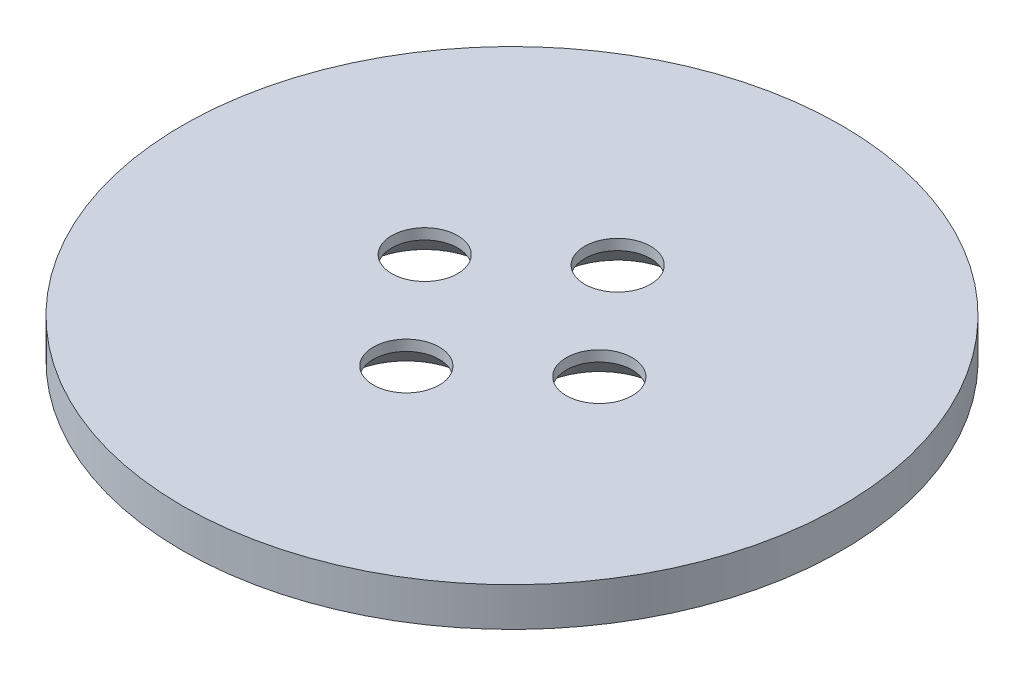
from build123d import *

# Parameters (mm, degrees)
SKETCH1_R                                    = 17
BOSS_EXTRUDE1_DEPTH                          = 2
CSK_FOR_M3_COUNTERSUNK_FLAT_HEAD_SCR_2_COUNT = 2
CSK_FOR_M3_COUNTERSUNK_FLAT_HEAD_SCR_2_PITCH = 7.071067812
CSK_FOR_M3_COUNTERSUNK_FLAT_HEAD_SCR_3_COUNT = 2
CSK_FOR_M3_COUNTERSUNK_FLAT_HEAD_SCR_3_PITCH = 10
CSK_FOR_M3_COUNTERSUNK_FLAT_HEAD_SCR_4_COUNT = 2
CSK_FOR_M3_COUNTERSUNK_FLAT_HEAD_SCR_4_PITCH = 7.071067812


with BuildPart() as part:
    # Sketch1 → Boss-Extrude1 (new body)
    with BuildSketch(Plane(origin=(0, 0, 0), x_dir=(1, 0, 0), z_dir=(0, 1, 0))):
        with Locations(Location((0, 0, 0), (0, 0, 270))):
            Circle(SKETCH1_R)
    extrude(amount=BOSS_EXTRUDE1_DEPTH)

    # Sketch3 → CSK for M3 Countersunk Flat Head Screw1 (revolve, cut)
    with BuildSketch(Plane(origin=(-4.977444323, 0, -0.474392252), x_dir=(0, 0, -1), z_dir=(1, 0, 0))):
        Polygon((0, 0), (0, 2), (1.7, 2), (1.7, 1.45), (3.15, 0), align=None)
    csk_for_m3_countersunk_flat_head_screw1 = revolve(axis=Axis((-4.977444323, -6.35, -0.474392252), (0, 1, 0)), mode=Mode.SUBTRACT)

    # CSK for M3 Countersunk Flat Head Scr 2: CSK for M3 Countersunk Flat Head Screw1 ×2
    with Locations(*[Vector(0.7710061224307119, 0, -0.6368277311599726) * (i * CSK_FOR_M3_COUNTERSUNK_FLAT_HEAD_SCR_2_PITCH) for i in range(1, CSK_FOR_M3_COUNTERSUNK_FLAT_HEAD_SCR_2_COUNT)]):
        add(csk_for_m3_countersunk_flat_head_screw1, mode=Mode.SUBTRACT)

    # CSK for M3 Countersunk Flat Head Scr 3: CSK for M3 Countersunk Flat Head Screw1 ×2
    with Locations(*[Vector(0.995488864657962, 0, 0.09487845035624153) * (i * CSK_FOR_M3_COUNTERSUNK_FLAT_HEAD_SCR_3_PITCH) for i in range(1, CSK_FOR_M3_COUNTERSUNK_FLAT_HEAD_SCR_3_COUNT)]):
        add(csk_for_m3_countersunk_flat_head_screw1, mode=Mode.SUBTRACT)

    # CSK for M3 Countersunk Flat Head Scr 4: CSK for M3 Countersunk Flat Head Screw1 ×2
    with Locations(*[Vector(0.6368277311599727, 0, 0.7710061224307118) * (i * CSK_FOR_M3_COUNTERSUNK_FLAT_HEAD_SCR_4_PITCH) for i in range(1, CSK_FOR_M3_COUNTERSUNK_FLAT_HEAD_SCR_4_COUNT)]):
        add(csk_for_m3_countersunk_flat_head_screw1, mode=Mode.SUBTRACT)


solid = part.part
